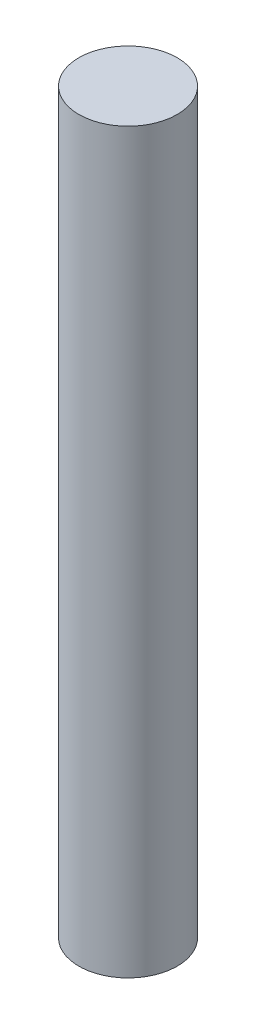
from build123d import *

# Parameters (mm, degrees)
SKETCH_1_R          = 5
EXTRUDE_1_DEPTH     = 7
EXTRUDE_START       = 68
SKETCH_2_R          = 5
EXTRUDE_2_DEPTH     = 68
SKETCH_3_R          = 3.5
CUT_EXTRUDE_1_DEPTH = 20


with BuildPart() as part:
    # ｽｹｯﾁ1 → ﾎﾞｽ - 押し出し1 (new body)
    with BuildSketch(Plane(origin=(0, 0, 0), x_dir=(1, 0, 0), z_dir=(0, 1, 0))):
        with Locations(Location((0, 0, 0), (0, 0, 270))):
            Circle(SKETCH_1_R)
    extrude(amount=EXTRUDE_1_DEPTH)

    # ｽｹｯﾁ2 → ﾎﾞｽ - 押し出し2 (add)
    with BuildSketch(Plane.XZ.offset(EXTRUDE_START)):
        with Locations(Location((0, 0, 0), (0, 0, 270))):
            Circle(SKETCH_2_R)
    extrude(amount=-EXTRUDE_2_DEPTH)

    # ｽｹｯﾁ3 → ｶｯﾄ - 押し出し1 (cut)
    with BuildSketch(Plane.XZ.offset(68)):
        with Locations(Location((0, 0, 0), (0, 0, 270))):
            Circle(SKETCH_3_R)
    extrude(amount=-CUT_EXTRUDE_1_DEPTH, mode=Mode.SUBTRACT)


solid = part.part
